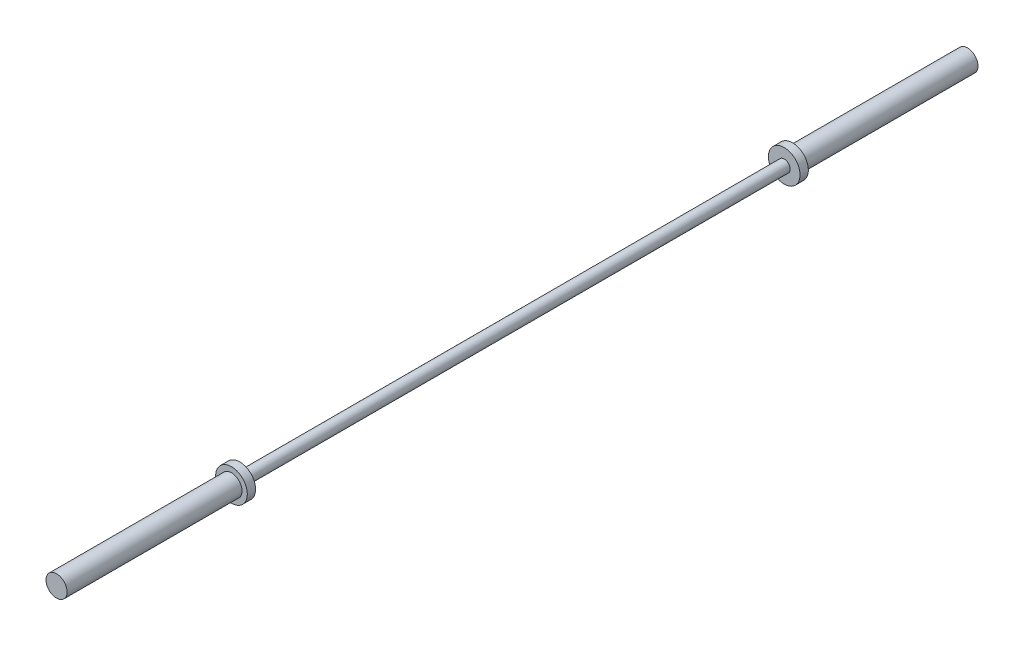
from build123d import *


with BuildPart() as part:
    # Sketch1 → Revolve1 (revolve)
    with BuildSketch(Plane(origin=(0, 0, 0), x_dir=(0, 0, -1), z_dir=(1, 0, 0)), mode=Mode.PRIVATE) as revolve1_sk:
        Polygon((0, 0), (-1100, 0), (-1100, 25.5), (-677.5, 25.5), (-677.5, 38.25), (-657.5, 38.25), (-657.5, 14.25), (0, 14.25), (657.5, 14.25), (657.5, 38.25), (677.5, 38.25), (677.5, 25.5), (1100, 25.5), (1100, 0), align=None)
    revolve(revolve1_sk.sketch.rotate(Axis((0, 0, 0), (0, 0, -1)), 90), axis=Axis((0, 0, 0), (0, 0, -1)))


solid = part.part
